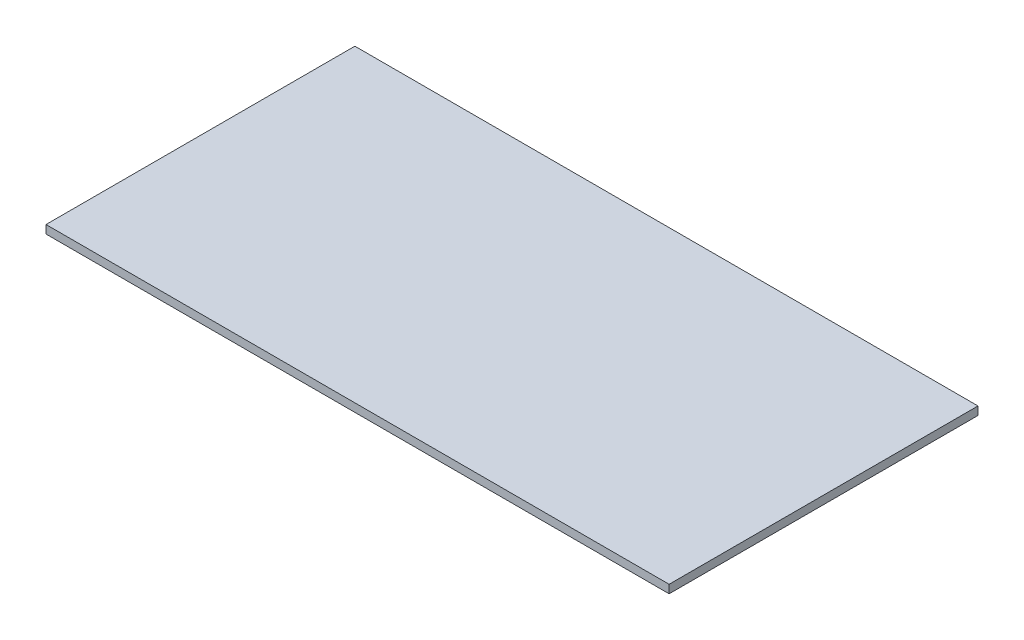
from build123d import *

# Parameters (mm, degrees)
SKETCH1_W           = 150.7
SKETCH1_H           = 74.7
BOSS_EXTRUDE1_DEPTH = 2


with BuildPart() as part:
    # Sketch1 → Boss-Extrude1 (new body)
    with BuildSketch(Plane(origin=(0, 0, 0), x_dir=(1, 0, 0), z_dir=(0, 1, 0))):
        Rectangle(SKETCH1_W, SKETCH1_H)
    extrude(amount=BOSS_EXTRUDE1_DEPTH)


solid = part.part
